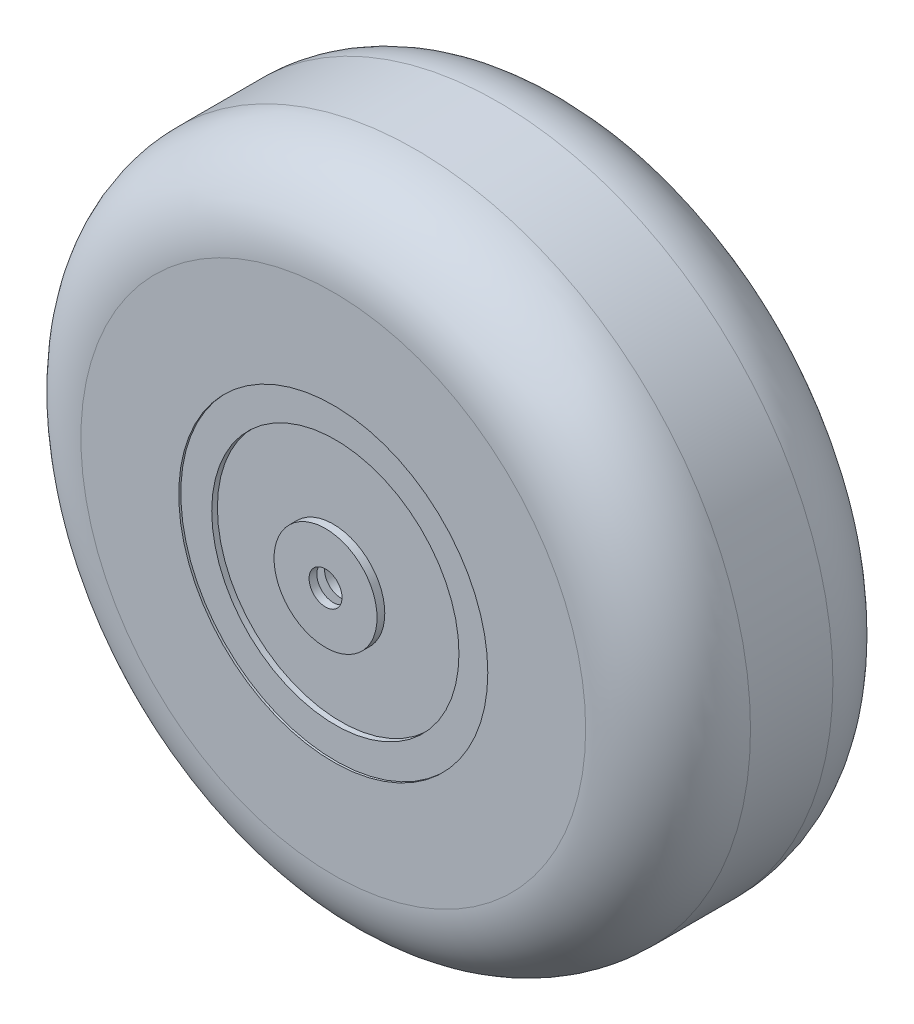
from build123d import *

# Parameters (mm, degrees)
SKETCH1_R           = 32.5
SKETCH1_R_2         = 1.6
BOSS_EXTRUDE1_DEPTH = 24
FILLET2_R           = 8
SKETCH3_R           = 5
BOSS_EXTRUDE2_DEPTH = 0.75
BOSS_EXTRUDE3_START = 0.75
SKETCH4_R           = 5
BOSS_EXTRUDE3_DEPTH = 0.75
SKETCH5_R           = 1.6
CUT_EXTRUDE1_DEPTH  = 40.75
SKETCH6_R           = 15
SKETCH6_R_2         = 12
CUT_EXTRUDE3_DEPTH  = 0.2
CUT_EXTRUDE5_START  = -0.75
SKETCH9_R           = 12
CUT_EXTRUDE5_DEPTH  = 0.75
SKETCH11_R          = 12
CUT_EXTRUDE6_DEPTH  = 0.75
SKETCH12_R          = 15
SKETCH12_R_2        = 12
CUT_EXTRUDE7_DEPTH  = 0.75


with BuildPart() as part:
    # Sketch1 → Boss-Extrude1 (new body)
    with BuildSketch(Plane.XY):
        Circle(SKETCH1_R)
        Circle(SKETCH1_R_2, mode=Mode.SUBTRACT)
    extrude(amount=BOSS_EXTRUDE1_DEPTH)

    # Fillet2
    fillet2_edges = [part.edges().sort_by_distance(p)[0] for p in [
        (-32.5, 0, 0),
        (-32.5, 0, 24),
    ]]
    fillet(fillet2_edges, radius=FILLET2_R)

    # Sketch3 → Boss-Extrude2 (add)
    with BuildSketch(Plane.XY.offset(24)):
        Circle(SKETCH3_R)
    extrude(amount=BOSS_EXTRUDE2_DEPTH)

    # Sketch4 → Boss-Extrude3 (add)
    with BuildSketch(Plane(origin=(0, 0, 0), x_dir=(-1, 0, 0), z_dir=(0, 0, -1)).offset(BOSS_EXTRUDE3_START)):
        with Locations(Location((0, 0, 0), (0, 0, 180))):
            Circle(SKETCH4_R)
    extrude(amount=-BOSS_EXTRUDE3_DEPTH)

    # Sketch5 → Cut-Extrude1 (cut)
    with BuildSketch(Plane(origin=(0, 0, -0.75), x_dir=(-1, 0, 0), z_dir=(0, 0, -1))):
        Circle(SKETCH5_R)
    extrude(amount=-CUT_EXTRUDE1_DEPTH, mode=Mode.SUBTRACT)

    # Sketch6 → Cut-Extrude3 (cut)
    with BuildSketch(Plane.XY.offset(24)):
        Circle(SKETCH6_R)
        Circle(SKETCH6_R_2, mode=Mode.SUBTRACT)
    extrude(amount=-CUT_EXTRUDE3_DEPTH, mode=Mode.SUBTRACT)

    # Sketch9 → Cut-Extrude5 (cut)
    with BuildSketch(Plane(origin=(0, 0, 0), x_dir=(-1, 0, 0), z_dir=(0, 0, -1)).offset(CUT_EXTRUDE5_START)):
        with Locations(Location((0, 0, 0), (0, 0, 180))):
            Circle(SKETCH9_R)
    extrude(amount=CUT_EXTRUDE5_DEPTH, mode=Mode.SUBTRACT)


with BuildPart() as cut_extrude5_piece_1:
    # of the separate pieces the step leaves, piece 1, a body of its own (cut_extrude5_pieces)
    add(part.part.solids().sort_by_distance((32.5, 0, 8))[0])

    # Sketch11 → Cut-Extrude6 (cut)
    with BuildSketch(Plane.XY.offset(24)):
        with Locations(Location((0, 0, 0), (0, 0, 180))):
            Circle(SKETCH11_R)
    extrude(amount=-CUT_EXTRUDE6_DEPTH, mode=Mode.SUBTRACT)


with BuildPart() as cut_extrude5_piece_2:
    # of the separate pieces the step leaves, piece 2, a body of its own (cut_extrude5_pieces)
    add(part.part.solids().sort_by_distance((5, 0, -0.75))[0])


with BuildPart() as cut_extrude6_piece_1:
    # of the separate pieces the step leaves, piece 1, a body of its own (cut_extrude6_pieces)
    add(cut_extrude5_piece_1.part.solids().sort_by_distance((32.5, 0, 8))[0])

    # Sketch12 → Cut-Extrude7 (cut)
    with BuildSketch(Plane(origin=(0, 0, 0), x_dir=(-1, 0, 0), z_dir=(0, 0, -1))):
        with Locations(Location((0, 0, 0), (0, 0, 180))):
            Circle(SKETCH12_R)
        with Locations(Location((0, 0, 0), (0, 0, 180))):
            Circle(SKETCH12_R_2, mode=Mode.SUBTRACT)
    extrude(amount=-CUT_EXTRUDE7_DEPTH, mode=Mode.SUBTRACT)


with BuildPart() as cut_extrude6_piece_2:
    # of the separate pieces the step leaves, piece 2, a body of its own (cut_extrude6_pieces)
    add(cut_extrude5_piece_1.part.solids().sort_by_distance((-1.6, 0, 24))[0])


solid = Compound([cut_extrude5_piece_2.part, cut_extrude6_piece_1.part, cut_extrude6_piece_2.part])
